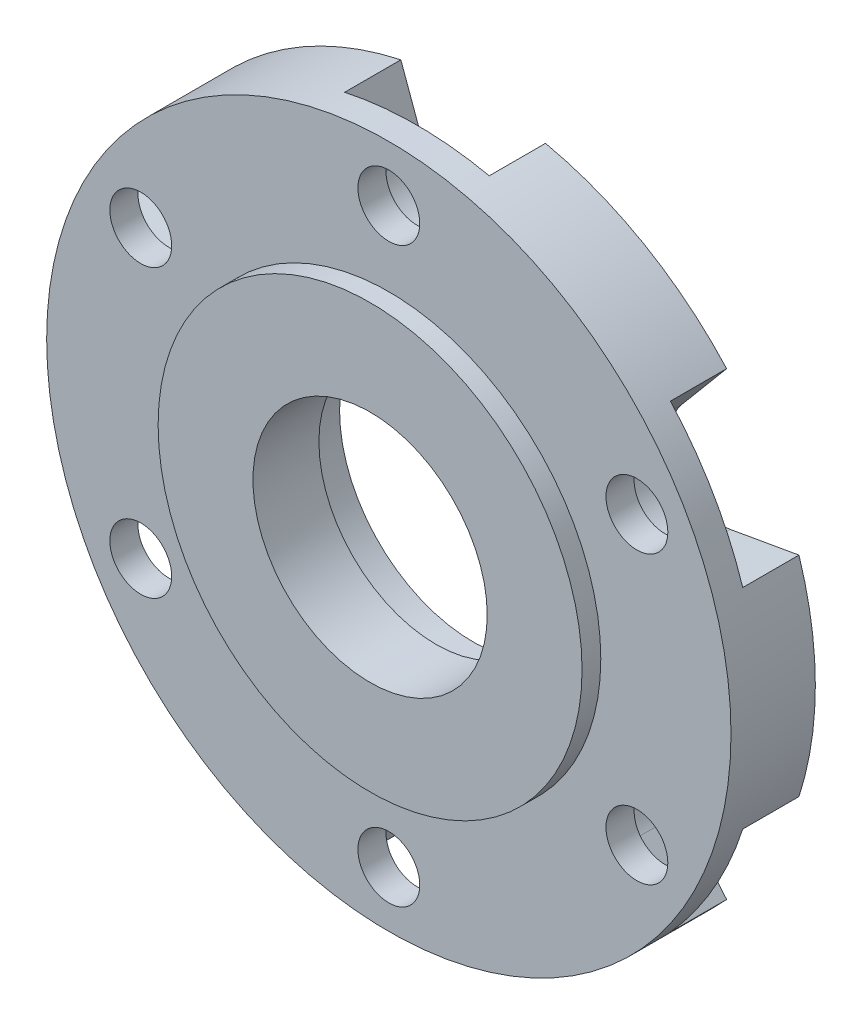
from build123d import *

# Parameters (mm, degrees)
SKETCH_SPINDLE_SKELETON_W      = 1.000000064
SKETCH_SPINDLE_SKELETON_H      = 10.1187
CUT_CENTER_DEPTH               = 53.414934066
CUT_CENTER_DEPTH_BACK          = 53.414934066
SKETCH_CENTER_CUT_R            = 12.5
CBORE_FOR_M6_SHCS1_D           = 6.6
CBORE_FOR_M6_SHCS1_CBORE_D     = 11
CBORE_FOR_M6_SHCS1_CBORE_DEPTH = 6
CIRPATTERN1_COUNT              = 6
SKETCH1_R                      = 14.25575
CUT_EXTRUDE1_DEPTH             = 3.9624
CUT_EXTRUDE2_DEPTH             = 6
CIRPATTERN2_COUNT              = 6


with BuildPart() as part:
    # Sketch Spindle Skeleton → Main Revolve (revolve)
    with BuildSketch(Plane(origin=(0, 0, 0), x_dir=(0, 0, -1), z_dir=(1, 0, 0)), mode=Mode.PRIVATE) as main_revolve_sk:
        Polygon((-25.304999936, 12.5), (-25.304999936, 9.525), (-16.304999902, 9.525), (-16.304999902, 36.5125), (-25.304999936, 36.5125), (-25.304999936, 22.6187), (-26.304999936, 22.6187), (-26.304999936, 12.5), align=None)
        with Locations((-26.804999968, 17.55935)):
            Rectangle(SKETCH_SPINDLE_SKELETON_W, SKETCH_SPINDLE_SKELETON_H)
    revolve(main_revolve_sk.sketch.rotate(Axis((0, 0, 1000), (0, 0, -1)), 90), axis=Axis((0, 0, 1000), (0, 0, -1)))

    # Sketch Center Cut → Cut Center (cut, two sides: drawn at the far end of the back side and taken through both)
    with BuildSketch(Plane.XY.offset(25.304999936).offset(-CUT_CENTER_DEPTH_BACK)):
        Circle(SKETCH_CENTER_CUT_R)
    extrude(amount=CUT_CENTER_DEPTH + CUT_CENTER_DEPTH_BACK, mode=Mode.SUBTRACT)

    # CBORE for M6 SHCS1 (through all)
    with Locations(Plane(origin=(0, 0, 16.304999902), x_dir=(-1, 0, 0), z_dir=(0, 0, -1))):
        with Locations((0, 30.565600032)):
            cbore_for_m6_shcs1 = CounterBoreHole(CBORE_FOR_M6_SHCS1_D / 2, CBORE_FOR_M6_SHCS1_CBORE_D / 2, CBORE_FOR_M6_SHCS1_CBORE_DEPTH)

    # CirPattern1: CBORE for M6 SHCS1 ×6 about axis
    cirpattern1_axis = Axis((0, 0, 0), (0, 0, 1))
    for i in range(1, CIRPATTERN1_COUNT):
        add(cbore_for_m6_shcs1.rotate(cirpattern1_axis, i * 360 / CIRPATTERN1_COUNT), mode=Mode.SUBTRACT)

    # Sketch1 → Cut-Extrude1 (cut)
    with BuildSketch(Plane(origin=(0, 0, 16.304999902), x_dir=(-1, 0, 0), z_dir=(0, 0, -1))):
        Circle(SKETCH1_R)
    extrude(amount=-CUT_EXTRUDE1_DEPTH, mode=Mode.SUBTRACT)

    # Sketch2 → Cut-Extrude2 (cut)
    with BuildSketch(Plane(origin=(0, 0, 16.304999902), x_dir=(-1, 0, 0), z_dir=(0, 0, -1))):
        with BuildLine():
            ThreePointArc((5.5, 30.565600032), (5.416442642, 29.610535055), (5.168309414, 28.684489244))
            Line((5.168309414, 28.684489244), (7.71724355, 35.687628224))
            ThreePointArc((7.71724355, 35.687628224), (3.88060116, 36.305696397), (0, 36.5125))
            Line((0, 36.5125), (0, 36.065600032))
            ThreePointArc((0, 36.065600032), (3.889087297, 34.454687329), (5.5, 30.565600032))
        make_face()
        with BuildLine():
            Line((-7.71724355, 35.687628224), (-5.168309414, 28.684489244))
            ThreePointArc((-5.168309414, 28.684489244), (-4.505336244, 33.720270432), (0, 36.065600032))
            Line((0, 36.065600032), (0, 36.5125))
            ThreePointArc((0, 36.5125), (-3.88060116, 36.305696397), (-7.71724355, 35.687628224))
        make_face()
    cut_extrude2 = extrude(amount=-CUT_EXTRUDE2_DEPTH, mode=Mode.SUBTRACT)

    # CirPattern2: Cut-Extrude2 ×6 about axis
    cirpattern2_axis = Axis((0, 0, 0), (0, 0, 1))
    for i in range(1, CIRPATTERN2_COUNT):
        add(cut_extrude2.rotate(cirpattern2_axis, i * 360 / CIRPATTERN2_COUNT), mode=Mode.SUBTRACT)


solid = part.part
